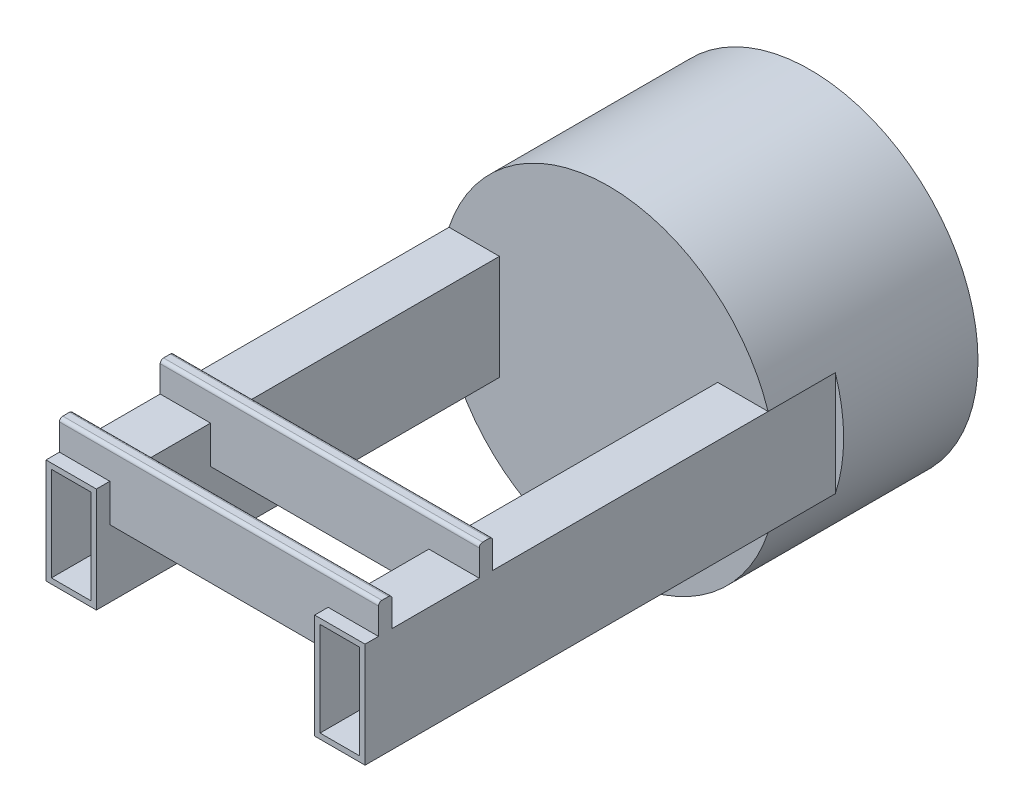
from build123d import *

# Parameters (mm, degrees)
IZIM1_W                      = 75
IZIM1_H                      = 156.12494996
Y_KSEKLIK_EKSTR_ZYON2_DEPTH  = 100
IZIM3_W                      = 75
IZIM3_H                      = 156.12494996
Y_KSEKLIK_EKSTR_ZYON3_DEPTH  = 600
Y_KSEKLIK_EKSTR_ZYON9_DEPTH  = 475
IZIM12_W                     = 59
IZIM12_H                     = 140.12494996
KES_EKSTR_ZYON3_DEPTH        = 781.324451751
Y_KSEKLIK_EKSTR_ZYON10_START = 200
IZIM13_R                     = 250
Y_KSEKLIK_EKSTR_ZYON10_DEPTH = 200
IZIM15_R                     = 225
KES_EKSTR_ZYON5_DEPTH        = 200


with BuildPart() as part:
    # Çizim1 → Yükseklik-Ekstrüzyon2 (new body)
    with BuildSketch(Plane.XY):
        with BuildLine():
            Line((162.5, 78.06247498), (237.5, 78.06247498))
            ThreePointArc((237.5, 78.06247498), (0, 250), (-237.5, 78.06247498))
            Line((-237.5, 78.06247498), (-162.5, 78.06247498))
            Line((-162.5, 78.06247498), (-162.5, -78.06247498))
            Line((-162.5, -78.06247498), (-237.5, -78.06247498))
            ThreePointArc((-237.5, -78.06247498), (0, -250), (237.5, -78.06247498))
            Line((237.5, -78.06247498), (162.5, -78.06247498))
            Line((162.5, -78.06247498), (162.5, 78.06247498))
        make_face()
        with Locations((-200, 0)):
            Rectangle(IZIM1_W, IZIM1_H)
        with Locations((200, 0)):
            Rectangle(IZIM1_W, IZIM1_H)
    extrude(amount=Y_KSEKLIK_EKSTR_ZYON2_DEPTH)

    # Çizim3 → Yükseklik-Ekstrüzyon3 (add)
    with BuildSketch(Plane.XY.offset(100)):
        with Locations((200, 0)):
            Rectangle(IZIM3_W, IZIM3_H)
        with Locations((-200, 0)):
            Rectangle(IZIM3_W, IZIM3_H)
    extrude(amount=Y_KSEKLIK_EKSTR_ZYON3_DEPTH)

    # Çizim5 → Yükseklik-Ekstrüzyon9 (add, through all)
    with BuildSketch(Plane.ZY.offset(237.5)):
        with BuildLine():
            Line((680, 22.081308318), (660, 22.081308318))
            Line((660, 22.081308318), (660, 117.081308318))
            ThreePointArc((660, 117.081308318), (661.464466094, 120.616842224), (665, 122.081308318))
            Line((665, 122.081308318), (675, 122.081308318))
            ThreePointArc((675, 122.081308318), (678.535533906, 120.616842224), (680, 117.081308318))
            Line((680, 117.081308318), (680, 22.081308318))
        make_face()
        with BuildLine():
            Line((530, 22.081308318), (510, 22.081308318))
            Line((510, 22.081308318), (510, 117.081308318))
            ThreePointArc((510, 117.081308318), (511.464466094, 120.616842224), (515, 122.081308318))
            Line((515, 122.081308318), (525, 122.081308318))
            ThreePointArc((525, 122.081308318), (528.535533906, 120.616842224), (530, 117.081308318))
            Line((530, 117.081308318), (530, 22.081308318))
        make_face()
    extrude(amount=-Y_KSEKLIK_EKSTR_ZYON9_DEPTH)

    # Çizim12 → Kes-Ekstrüzyon3 (cut, through all)
    with BuildSketch(Plane.XY.offset(700)):
        with Locations((-200, 0)):
            Rectangle(IZIM12_W, IZIM12_H)
        with Locations((200, 0)):
            Rectangle(IZIM12_W, IZIM12_H)
    extrude(amount=-KES_EKSTR_ZYON3_DEPTH, mode=Mode.SUBTRACT)

    # Çizim13 → Yükseklik-Ekstrüzyon10 (add)
    with BuildSketch(Plane(origin=(0, 0, 0), x_dir=(-1, 0, 0), z_dir=(0, 0, -1)).offset(Y_KSEKLIK_EKSTR_ZYON10_START)):
        Circle(IZIM13_R)
    extrude(amount=-Y_KSEKLIK_EKSTR_ZYON10_DEPTH)

    # Çizim15 → Kes-Ekstrüzyon5 (cut)
    with BuildSketch(Plane(origin=(0, 0, -200), x_dir=(-1, 0, 0), z_dir=(0, 0, -1))):
        Circle(IZIM15_R)
    extrude(amount=-KES_EKSTR_ZYON5_DEPTH, mode=Mode.SUBTRACT)


solid = part.part
